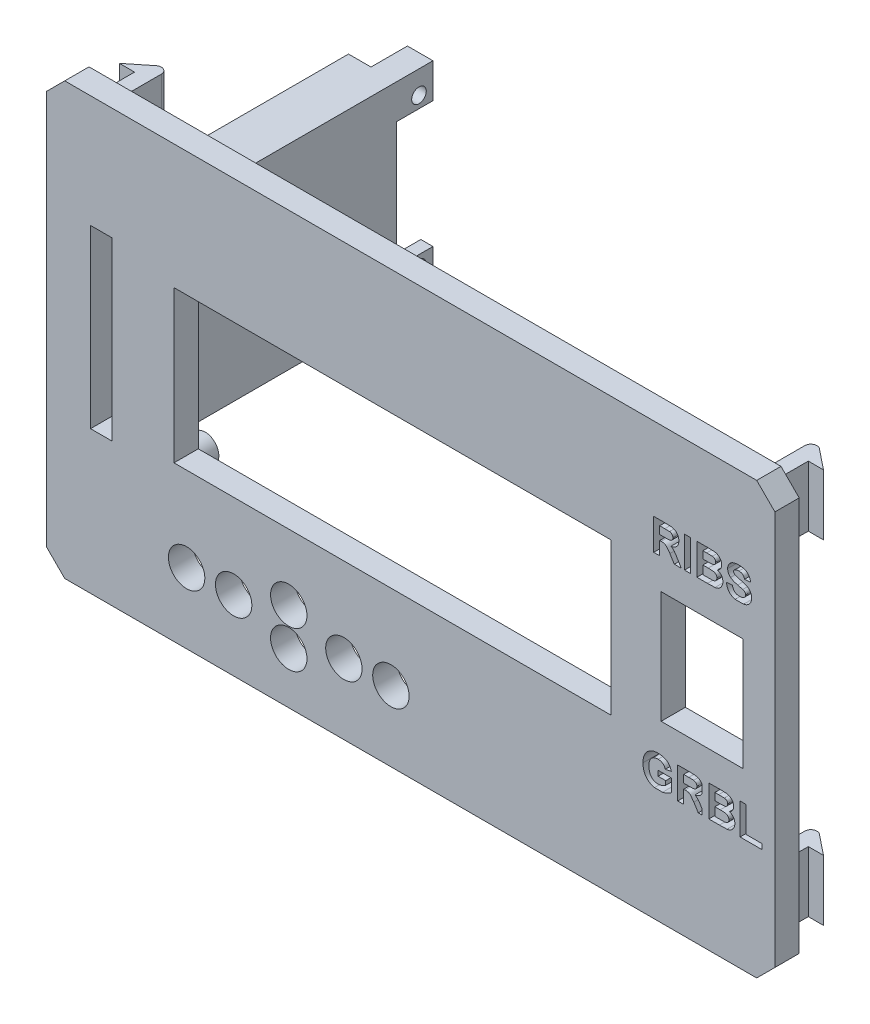
from build123d import *

# Parameters (mm, degrees)
SKETCH_1_W           = 120
SKETCH_1_H           = 60
EXTRUDE_1_DEPTH      = 4
SKETCH_2_W           = 72
SKETCH_2_H           = 25
CUT_EXTRUDE_1_DEPTH  = 68.201190466
SKETCH_3_W           = 6.75
SKETCH_3_H           = 18.5
CUT_EXTRUDE_2_DEPTH  = 68.201190466
SKETCH_4_W           = 1.75
SKETCH_4_H           = 29
CUT_EXTRUDE_3_DEPTH  = 68.201190466
SKETCH_5_W           = 120
SKETCH_5_H           = 4
EXTRUDE_2_DEPTH      = 5
SKETCH_6_W           = 120
SKETCH_6_H           = 4
EXTRUDE_3_DEPTH      = 10
SKETCH_7_R           = 2
CUT_EXTRUDE_4_DEPTH  = 73.221880341
SKETCH_8_R           = 2
CUT_EXTRUDE_5_DEPTH  = 73.221880341
SKETCH_10_R          = 2
CUT_EXTRUDE_6_DEPTH  = 73.221880341
SKETCH_11_R          = 2
CUT_EXTRUDE_8_DEPTH  = 10
SKETCH_12_R          = 3
CUT_EXTRUDE_9_DEPTH  = 10
SKETCH_13_R          = 2.25
EXTRUDE_4_DEPTH      = 3
SKETCH_14_W          = 68.3
SKETCH_14_H          = 3
CUT_EXTRUDE_10_DEPTH = 2
SKETCH_15_R          = 1.25
CUT_EXTRUDE_11_DEPTH = 6
EXTRUDE_5_DEPTH      = 40
EXTRUDE_6_DEPTH      = 6
CUT_EXTRUDE_12_DEPTH = 120.97740996
SKETCH_19_W          = 4
SKETCH_19_H          = 75
EXTRUDE_7_DEPTH      = 3
SKETCH_20_W          = 4
SKETCH_20_H          = 75
CUT_EXTRUDE_13_DEPTH = 3
SKETCH_21_W          = 0.987814879
SKETCH_21_H          = 5.13663737
CUT_EXTRUDE_15_DEPTH = 3
SKETCH_22_W          = 120
SKETCH_22_H          = 4
CUT_EXTRUDE_16_DEPTH = 2
SKETCH_23_W          = 120
SKETCH_23_H          = 4
CUT_EXTRUDE_17_DEPTH = 2
CHAMFER_1_SIZE       = 3
SKETCH_24_W          = 2.5
SKETCH_24_H          = 10
EXTRUDE_8_DEPTH      = 6
EXTRUDE_9_DEPTH      = 10
EXTRUDE_10_DEPTH     = 10
FILLET_1_R           = 1


with BuildPart() as part:
    # Эскиз1 → Бобышка-Вытянуть1 (new body)
    with BuildSketch(Plane.XY):
        Rectangle(SKETCH_1_W, SKETCH_1_H)
    extrude(amount=EXTRUDE_1_DEPTH)

    # Эскиз2 → Вырез-Вытянуть1 (cut, through all)
    with BuildSketch(Plane.XY.offset(4)):
        Rectangle(SKETCH_2_W, SKETCH_2_H)
    extrude(amount=-CUT_EXTRUDE_1_DEPTH, mode=Mode.SUBTRACT)

    # Эскиз3 → Вырез-Вытянуть2 (cut, through all)
    with BuildSketch(Plane.XY.offset(4)):
        with Locations((54.375, 0)):
            Rectangle(SKETCH_3_W, SKETCH_3_H)
        with Locations((47.625, 0)):
            Rectangle(SKETCH_3_W, SKETCH_3_H)
    extrude(amount=-CUT_EXTRUDE_2_DEPTH, mode=Mode.SUBTRACT)

    # Эскиз4 → Вырез-Вытянуть3 (cut, through all)
    with BuildSketch(Plane.XY.offset(4)):
        with Locations((-47.125, 0)):
            Rectangle(SKETCH_4_W, SKETCH_4_H)
        with Locations((-48.875, 0)):
            Rectangle(SKETCH_4_W, SKETCH_4_H)
    extrude(amount=-CUT_EXTRUDE_3_DEPTH, mode=Mode.SUBTRACT)

    # Эскиз5 → Бобышка-Вытянуть2 (add)
    with BuildSketch(Plane(origin=(0, 30, 0), x_dir=(1, 0, 0), z_dir=(0, 1, 0))):
        with Locations((0, -2)):
            Rectangle(SKETCH_5_W, SKETCH_5_H)
    extrude(amount=EXTRUDE_2_DEPTH)

    # Эскиз6 → Бобышка-Вытянуть3 (add)
    with BuildSketch(Plane.XZ.offset(30)):
        with Locations((0, 2)):
            Rectangle(SKETCH_6_W, SKETCH_6_H)
    extrude(amount=EXTRUDE_3_DEPTH)

    # Эскиз7 → Вырез-Вытянуть4 (cut, through all)
    with BuildSketch(Plane(origin=(0, 0, 0), x_dir=(-1, 0, 0), z_dir=(0, 0, -1))):
        with Locations((33.92, -26.42)):
            Circle(SKETCH_7_R)
    extrude(amount=-CUT_EXTRUDE_4_DEPTH, mode=Mode.SUBTRACT)

    # Эскиз8 → Вырез-Вытянуть5 (cut, through all)
    with BuildSketch(Plane(origin=(0, 0, 0), x_dir=(-1, 0, 0), z_dir=(0, 0, -1))):
        with Locations((26.173, -26.42)):
            Circle(SKETCH_8_R)
    extrude(amount=-CUT_EXTRUDE_5_DEPTH, mode=Mode.SUBTRACT)

    # Эскиз10 → Вырез-Вытянуть6 (cut, through all)
    with BuildSketch(Plane(origin=(0, 0, 0), x_dir=(-1, 0, 0), z_dir=(0, 0, -1))):
        with Locations((0.266, -26.42)):
            Circle(SKETCH_10_R)
        with Locations((8.013, -26.42)):
            Circle(SKETCH_10_R)
    extrude(amount=-CUT_EXTRUDE_6_DEPTH, mode=Mode.SUBTRACT)

    # Эскиз11 → Вырез-Вытянуть8 (cut)
    with BuildSketch(Plane(origin=(0, 0, 0), x_dir=(-1, 0, 0), z_dir=(0, 0, -1))):
        with Locations((17.093, -29.52)):
            Circle(SKETCH_11_R)
        with Locations((17.093, -23.35)):
            Circle(SKETCH_11_R)
    extrude(amount=-CUT_EXTRUDE_8_DEPTH, mode=Mode.SUBTRACT)

    # Эскиз12 → Вырез-Вытянуть9 (cut)
    with BuildSketch(Plane(origin=(0, 0, 0), x_dir=(-1, 0, 0), z_dir=(0, 0, -1))):
        with Locations((33.92, -26.42)):
            Circle(SKETCH_12_R)
        with Locations((26.173, -26.42)):
            Circle(SKETCH_12_R)
        with Locations((17.093, -29.52)):
            Circle(SKETCH_12_R)
        with Locations((17.093, -23.35)):
            Circle(SKETCH_12_R)
        with Locations((8.013, -26.42)):
            Circle(SKETCH_12_R)
        with Locations((0.266, -26.42)):
            Circle(SKETCH_12_R)
    extrude(amount=-CUT_EXTRUDE_9_DEPTH, mode=Mode.SUBTRACT)

    # Эскиз13 → Бобышка-Вытянуть4 (add)
    with BuildSketch(Plane(origin=(0, 0, 0), x_dir=(-1, 0, 0), z_dir=(0, 0, -1))):
        with Locations(Location((37.86, -14.789, 0), (0, 0, 180))):
            Circle(SKETCH_13_R)
        with Locations(Location((-37.64, -14.789, 0), (0, 0, 180))):
            Circle(SKETCH_13_R)
        with Locations(Location((-37.64, 16.711, 0), (0, 0, 180))):
            Circle(SKETCH_13_R)
        with Locations(Location((37.86, 16.711, 0), (0, 0, 180))):
            Circle(SKETCH_13_R)
    extrude(amount=EXTRUDE_4_DEPTH)

    # Эскиз14 → Вырез-Вытянуть10 (cut)
    with BuildSketch(Plane(origin=(0, 0, 0), x_dir=(-1, 0, 0), z_dir=(0, 0, -1))):
        with Locations((0.11, 17.461)):
            Rectangle(SKETCH_14_W, SKETCH_14_H)
    extrude(amount=-CUT_EXTRUDE_10_DEPTH, mode=Mode.SUBTRACT)

    # Эскиз15 → Вырез-Вытянуть11 (cut)
    with BuildSketch(Plane(origin=(0, 0, -3), x_dir=(-1, 0, 0), z_dir=(0, 0, -1))):
        with Locations((37.86, -14.789)):
            Circle(SKETCH_15_R)
        with Locations((37.86, 16.711)):
            Circle(SKETCH_15_R)
        with Locations((-37.64, 16.711)):
            Circle(SKETCH_15_R)
        with Locations((-37.64, -14.789)):
            Circle(SKETCH_15_R)
    extrude(amount=-CUT_EXTRUDE_11_DEPTH, mode=Mode.SUBTRACT)

    # Эскиз16 → Бобышка-Вытянуть5 (add)
    with BuildSketch(Plane(origin=(0, 0, 0), x_dir=(-1, 0, 0), z_dir=(0, 0, -1))):
        Polygon((51.25, -14.5), (51.25, 13.569290618), (51.25, 16.2), (43.337209662, 16.2), (43.337209662, -16), (51.25, -16), align=None)
        Polygon((49.75, 14.5), (49.75, -14.5), (46.25, -14.5), (45.337209662, -14.5), (45.337209662, 14.5), (45.337209662, 14.7), (49.75, 14.7), align=None, mode=Mode.SUBTRACT)
    extrude(amount=EXTRUDE_5_DEPTH)

    # Эскиз17 → Бобышка-Вытянуть6 (add)
    with BuildSketch(Plane(origin=(0, 0, -40), x_dir=(-1, 0, 0), z_dir=(0, 0, -1))):
        Polygon((43.337209662, 16.2), (43.337209662, 10.5), (45.337209662, 10.5), (45.337209662, 14.7), (47.543604831, 14.7), (47.543604831, 16.2), align=None)
        Polygon((47.543604831, -16), (47.543604831, -14.5), (45.337209662, -14.5), (45.337209662, -10.3), (43.337209662, -10.3), (43.337209662, -16), align=None)
    extrude(amount=EXTRUDE_6_DEPTH)

    # Эскиз18 → Вырез-Вытянуть12 (cut, through all)
    with BuildSketch(Plane(origin=(-43.337209662, 0, 0), x_dir=(0, 0, -1), z_dir=(1, 0, 0))):
        with BuildLine():
            ThreePointArc((43.7, -11.016), (42.5, -12.216), (43.7, -13.416))
            Line((43.7, -13.416), (43.7, -12.216))
            Line((43.7, -12.216), (43.7, -11.016))
        make_face()
        with BuildLine():
            Line((43.7, -12.216), (43.7, -13.416))
            ThreePointArc((43.7, -13.416), (44.548528137, -13.064528137), (44.9, -12.216))
            ThreePointArc((44.9, -12.216), (44.548528137, -11.367471863), (43.7, -11.016))
            Line((43.7, -11.016), (43.7, -12.216))
        make_face()
        with BuildLine():
            ThreePointArc((43.7, 13.616), (42.5, 12.416), (43.7, 11.216))
            Line((43.7, 11.216), (43.7, 13.616))
        make_face()
        with BuildLine():
            Line((43.7, 13.616), (43.7, 11.216))
            ThreePointArc((43.7, 11.216), (44.548528137, 11.567471863), (44.9, 12.416))
            ThreePointArc((44.9, 12.416), (44.548528137, 13.264528137), (43.7, 13.616))
        make_face()
    extrude(amount=-CUT_EXTRUDE_12_DEPTH, mode=Mode.SUBTRACT)

    # Эскиз19 → Бобышка-Вытянуть7 (add)
    with BuildSketch(Plane(origin=(60, 0, 0), x_dir=(0, 0, -1), z_dir=(1, 0, 0))):
        with Locations((-2, -2.5)):
            Rectangle(SKETCH_19_W, SKETCH_19_H)
    extrude(amount=EXTRUDE_7_DEPTH)

    # Эскиз20 → Вырез-Вытянуть13 (cut)
    with BuildSketch(Plane.ZY.offset(60)):
        with Locations((2, -2.5)):
            Rectangle(SKETCH_20_W, SKETCH_20_H)
    extrude(amount=-CUT_EXTRUDE_13_DEPTH, mode=Mode.SUBTRACT)

    # Эскиз21 → Вырез-Вытянуть15 (cut)
    # profile 1 of 8: a face of its own
    with BuildSketch(Plane.XY.offset(4)):
        Polygon((57.256160899, -14.11336263), (57.256160899, -19.25), (60.878148788, -19.25), (60.878148788, -18.393893772), (58.243975778, -18.393893772), (58.243975778, -14.11336263), align=None)
    # profile 2 of 8: a face of its own
    with BuildSketch(Plane.XY.offset(4)):
        with BuildLine():
            Line((52.119523529, -14.11336263), (52.119523529, -19.25))
            Line((52.119523529, -19.25), (53.858489306, -19.25))
            add(Edge.make_bspline(
                [(55.103547642, -19.21501489), (55.045322411, -19.220185633), (54.946583854, -19.227242946), (54.79966707, -19.232786931), (54.6556309, -19.238260275), (54.488578224, -19.24219051), (54.220351639, -19.246050896), (54.007705019, -19.249540881), (53.858489306, -19.25)],
                knots=[0, 0, 0, 0, 0.140766497, 0.238315848, 0.354022328, 0.487866729, 0.640687248, 1, 1, 1, 1], degree=3))
            add(Edge.make_bspline(
                [(56.400054671, -17.761074865), (56.399362919, -17.876865656), (56.380396983, -18.052332398), (56.310932338, -18.277819771), (56.240520589, -18.443526002), (56.152945886, -18.599776063), (56.050017915, -18.742433041), (55.929920019, -18.866552348), (55.796925805, -18.975942554), (55.647053468, -19.066415362), (55.418761428, -19.162111895), (55.232298125, -19.201586823), (55.103547642, -19.21501489)],
                knots=[0, 0, 0, 0, 0.162134877, 0.244884357, 0.329396712, 0.41363605, 0.495043982, 0.574816901, 0.654648996, 0.735397766, 0.818838922, 1, 1, 1, 1], degree=3))
            add(Edge.make_bspline(
                [(55.506905385, -16.520132423), (55.576021362, -16.542547797), (55.676779076, -16.580910554), (55.801475492, -16.648471023), (55.887560605, -16.703696898), (55.968032048, -16.764654285), (56.040546682, -16.833332617), (56.109263327, -16.905832782), (56.169591333, -16.98579186), (56.224197353, -17.069386096), (56.270549912, -17.15792382), (56.310686604, -17.249275267), (56.344256518, -17.344365892), (56.368175402, -17.443829938), (56.394083351, -17.582222318), (56.398595697, -17.689331837), (56.400054671, -17.761074865)],
                knots=[0, 0, 0, 0, 0.132556806, 0.195780264, 0.258216645, 0.318868125, 0.379477695, 0.440087264, 0.500738744, 0.56178533, 0.621918965, 0.682673484, 0.743575816, 0.805446126, 0.868974916, 1, 1, 1, 1], degree=3))
            add(Edge.make_bspline(
                [(56.202491695, -15.405753763), (56.203306389, -15.522404941), (56.180164906, -15.696918197), (56.10116081, -15.916458133), (56.018614829, -16.070147918), (55.917309299, -16.211070963), (55.757309728, -16.377195725), (55.611349452, -16.471818422), (55.506905385, -16.520132423)],
                knots=[0, 0, 0, 0, 0.252157198, 0.376787363, 0.502925804, 0.62834201, 0.751131965, 1, 1, 1, 1], degree=3))
            add(Edge.make_bspline(
                [(54.188789906, -14.11336263), (54.284815014, -14.114228536), (54.424146404, -14.114048036), (54.603133128, -14.12049562), (54.722617182, -14.124516318), (54.831904453, -14.133907019), (54.931853489, -14.141286067), (55.022149692, -14.151437301), (55.128520967, -14.167865126), (55.25221197, -14.193417415), (55.391917938, -14.240682253), (55.524345464, -14.299735041), (55.647504193, -14.374811626), (55.761802647, -14.462618409), (55.868117179, -14.562456009), (55.961535404, -14.678358751), (56.045682404, -14.804857703), (56.116612945, -14.942058752), (56.183035191, -15.141364576), (56.202633111, -15.299311994), (56.202491695, -15.405753763)],
                knots=[0, 0, 0, 0, 0.105884058, 0.15355278, 0.1974569, 0.237652956, 0.27445636, 0.307946195, 0.337787549, 0.393116516, 0.446925741, 0.500063811, 0.55265689, 0.60552249, 0.65874794, 0.713022825, 0.769236291, 0.82605694, 0.882736495, 1, 1, 1, 1], degree=3))
            Line((54.188789906, -14.11336263), (52.119523529, -14.11336263))
        make_face()
        with BuildLine():
            Line((53.107338408, -18.393893772), (53.107338408, -17.010952941))
            Line((53.107338408, -17.010952941), (53.987111035, -17.010952941))
            add(Edge.make_bspline(
                [(55.412239792, -17.71682899), (55.412678398, -17.64399113), (55.399462141, -17.536785496), (55.348043827, -17.40613013), (55.29596156, -17.320133933), (55.230813568, -17.242664915), (55.150298337, -17.17783511), (55.057336166, -17.123821489), (54.96871715, -17.088237986), (54.884683037, -17.06540903), (54.804532188, -17.05043281), (54.70793403, -17.038577901), (54.595356808, -17.028550411), (54.466344067, -17.020529538), (54.261952739, -17.011635623), (54.100289199, -17.011477849), (53.987111035, -17.010952941)],
                knots=[0, 0, 0, 0, 0.12069588, 0.176255416, 0.231266923, 0.286442241, 0.34292522, 0.401445762, 0.463857631, 0.500356262, 0.54545082, 0.598687676, 0.661395797, 0.732507568, 0.812630315, 1, 1, 1, 1], degree=3))
            add(Edge.make_bspline(
                [(54.863796739, -18.361995583), (54.940554815, -18.349669052), (55.0504176, -18.312910259), (55.179540892, -18.233131661), (55.261887168, -18.158116206), (55.329486824, -18.0681539), (55.397194747, -17.92325915), (55.41268467, -17.800139536), (55.412239792, -17.71682899)],
                knots=[0, 0, 0, 0, 0.250407824, 0.369282527, 0.487614715, 0.607842641, 0.730167532, 1, 1, 1, 1], degree=3))
            add(Edge.make_bspline(
                [(54.115732764, -18.393893772), (54.204936242, -18.39557902), (54.332152, -18.392105042), (54.492724192, -18.390614404), (54.593184713, -18.38575929), (54.67999412, -18.382059572), (54.769116923, -18.376517052), (54.828636783, -18.36785756), (54.863796739, -18.361995583)],
                knots=[0, 0, 0, 0, 0.356994199, 0.509418466, 0.642709622, 0.759541115, 0.857263317, 1, 1, 1, 1], degree=3))
            Line((54.115732764, -18.393893772), (53.107338408, -18.393893772))
        make_face(mode=Mode.SUBTRACT)
        with BuildLine():
            Line((53.107338408, -16.154846713), (53.107338408, -14.969468859))
            Line((53.107338408, -14.969468859), (53.733983472, -14.969468859))
            add(Edge.make_bspline(
                [(54.666233764, -14.986961414), (54.626565734, -14.982719003), (54.557554814, -14.98012167), (54.452905101, -14.976360256), (54.345897147, -14.973147296), (54.219665513, -14.971227799), (54.01352172, -14.970245088), (53.849575417, -14.968685169), (53.733983472, -14.969468859)],
                knots=[0, 0, 0, 0, 0.128239885, 0.22208111, 0.336874893, 0.472602106, 0.628175186, 1, 1, 1, 1], degree=3))
            add(Edge.make_bspline(
                [(55.214676816, -15.553925995), (55.21649753, -15.480473167), (55.199081409, -15.373053293), (55.140010966, -15.244699981), (55.077643875, -15.164159032), (54.999276742, -15.096171173), (54.865248754, -15.021793433), (54.747245956, -14.998159305), (54.666233764, -14.986961414)],
                knots=[0, 0, 0, 0, 0.250585524, 0.366013953, 0.47979182, 0.596199355, 0.718553119, 1, 1, 1, 1], degree=3))
            add(Edge.make_bspline(
                [(54.613756098, -16.137354158), (54.698968319, -16.126437924), (54.823393391, -16.101246625), (54.967147883, -16.025547691), (55.056214644, -15.957709177), (55.126847471, -15.87444575), (55.198012887, -15.743547156), (55.214140273, -15.62974856), (55.214676816, -15.553925995)],
                knots=[0, 0, 0, 0, 0.279180569, 0.403146506, 0.522444612, 0.638838486, 0.753412678, 1, 1, 1, 1], degree=3))
            add(Edge.make_bspline(
                [(53.822475221, -16.154846713), (53.918517321, -16.155617321), (54.055023811, -16.154069718), (54.227212386, -16.153080834), (54.333895429, -16.151156105), (54.425465788, -16.147917556), (54.517086753, -16.144170595), (54.57820681, -16.141458558), (54.613756098, -16.137354158)],
                knots=[0, 0, 0, 0, 0.363928509, 0.517301829, 0.652498452, 0.768239873, 0.864498693, 1, 1, 1, 1], degree=3))
            Line((53.822475221, -16.154846713), (53.107338408, -16.154846713))
        make_face(mode=Mode.SUBTRACT)
    # profile 3 of 8: a face of its own
    with BuildSketch(Plane.XY.offset(4)):
        with BuildLine():
            Line((51, -16.183461309), (51, -14.902241447))
            add(Edge.make_bspline(
                [(49.138586338, -14.11336263), (49.26479759, -14.114004843), (49.447587509, -14.115593882), (49.68134182, -14.132108232), (49.836278165, -14.145569139), (49.977016975, -14.165157474), (50.104113613, -14.188623395), (50.217354358, -14.215817322), (50.3183914, -14.248386421), (50.41051666, -14.285662896), (50.496335859, -14.330032386), (50.576792605, -14.382016698), (50.653122635, -14.439824073), (50.725649175, -14.503543337), (50.792383936, -14.574860815), (50.8544896, -14.652714568), (50.911916114, -14.736456847), (50.959652312, -14.820684308), (50.988072752, -14.8766094), (51, -14.902241447)],
                knots=[0, 0, 0, 0, 0.134567806, 0.194654679, 0.249727294, 0.300288627, 0.346032105, 0.387437549, 0.424315851, 0.459073089, 0.493244826, 0.5271141, 0.561038568, 0.595222036, 0.629875307, 0.66498639, 0.701285794, 0.737967896, 0.768099566, 0.768099566, 0.768099566, 0.768099566], degree=3))
            Line((49.138586338, -14.11336263), (46.98288616, -14.11336263))
            Line((46.98288616, -14.11336263), (46.98288616, -19.25))
            Line((46.98288616, -19.25), (47.970701038, -19.25))
            Line((47.970701038, -19.25), (47.970701038, -17.076807267))
            Line((47.970701038, -17.076807267), (48.191930412, -17.076807267))
            add(Edge.make_bspline(
                [(49.641754542, -18.084172648), (49.577696091, -17.995038042), (49.48617796, -17.867657262), (49.367069146, -17.708904586), (49.292585593, -17.608420592), (49.224453096, -17.52306347), (49.164740418, -17.45134589), (49.114663833, -17.391728871), (49.058002053, -17.332616007), (48.992082087, -17.271864551), (48.910478432, -17.212962131), (48.826679059, -17.166007188), (48.736894692, -17.130174235), (48.633061923, -17.105211319), (48.450338886, -17.081771215), (48.300151361, -17.075476493), (48.191930412, -17.076807267)],
                knots=[0, 0, 0, 0, 0.174865068, 0.249829139, 0.316160129, 0.374099921, 0.423769715, 0.464839405, 0.498074588, 0.554160746, 0.60738754, 0.658015759, 0.7068185, 0.760885579, 0.827647236, 1, 1, 1, 1], degree=3))
            Line((49.641754542, -18.084172648), (50.372325962, -19.25))
            Line((50.372325962, -19.25), (51, -19.25))
            Line((51, -19.25), (51, -18.389648617))
            Line((51, -18.389648617), (50.904305434, -18.233373854))
            add(Edge.make_bspline(
                [(49.843433413, -16.949214511), (49.942625885, -17.012742493), (50.083700181, -17.113817956), (50.250023252, -17.267359138), (50.342479793, -17.367407932), (50.413509594, -17.455416598), (50.470702966, -17.532385744), (50.532394116, -17.620967573), (50.597980791, -17.721207446), (50.669393219, -17.832223733), (50.77301534, -18.003688521), (50.851324961, -18.139038574), (50.904305434, -18.233373854)],
                knots=[0, 0, 0, 0, 0.209649261, 0.307658185, 0.402218569, 0.451671994, 0.50877915, 0.572757208, 0.643659616, 0.721852347, 0.807549467, 1, 1, 1, 1], degree=3))
            add(Edge.make_bspline(
                [(51, -16.183461309), (50.984446716, -16.21674858), (50.949423575, -16.285364745), (50.885971982, -16.385110101), (50.810167515, -16.481301292), (50.724271936, -16.570572534), (50.627909223, -16.651087386), (50.521767001, -16.723157858), (50.405204311, -16.786378672), (50.279028394, -16.840394003), (50.092699517, -16.90268437), (49.945058979, -16.933275753), (49.843433413, -16.949214511)],
                knots=[0.314571643, 0.314571643, 0.314571643, 0.314571643, 0.366645189, 0.42372163, 0.481910522, 0.5400445, 0.599083027, 0.659656408, 0.721688575, 0.786832952, 0.854048925, 1, 1, 1, 1], degree=3))
        make_face()
        with BuildLine():
            Line((48.766097811, -16.220701038), (47.970701038, -16.220701038))
            Line((47.970701038, -16.220701038), (47.970701038, -14.969468859))
            Line((47.970701038, -14.969468859), (48.810343685, -14.969468859))
            add(Edge.make_bspline(
                [(49.595450719, -14.98593244), (49.56301346, -14.981653473), (49.50564711, -14.97912727), (49.41849861, -14.975066358), (49.32825857, -14.973586248), (49.221944967, -14.971082542), (49.047347545, -14.970363669), (48.908445875, -14.96861397), (48.810343685, -14.969468859)],
                knots=[0, 0, 0, 0, 0.124812716, 0.219210218, 0.333205091, 0.469464021, 0.625352362, 1, 1, 1, 1], degree=3))
            add(Edge.make_bspline(
                [(50.143893772, -15.581708289), (50.1429498, -15.505863776), (50.129693237, -15.392937783), (50.065641527, -15.261016964), (50.001865472, -15.177518496), (49.921736843, -15.107050399), (49.789742491, -15.029409497), (49.674855427, -14.99890848), (49.595450719, -14.98593244)],
                knots=[0, 0, 0, 0, 0.256355572, 0.372787533, 0.488671199, 0.607002185, 0.728890297, 1, 1, 1, 1], degree=3))
            add(Edge.make_bspline(
                [(48.766097811, -16.220701038), (48.883088411, -16.221345285), (49.04942034, -16.218028197), (49.259407671, -16.213595902), (49.389373772, -16.205864631), (49.50128949, -16.198187678), (49.594706198, -16.188214289), (49.670410882, -16.176425339), (49.746027157, -16.158096787), (49.823483825, -16.126162924), (49.906038354, -16.080679438), (49.976594362, -16.021676013), (50.037716991, -15.95345853), (50.08432699, -15.873276272), (50.134481067, -15.751735768), (50.141758594, -15.649721469), (50.143893772, -15.581708289)],
                knots=[0, 0, 0, 0, 0.202180464, 0.287584002, 0.362990417, 0.427193792, 0.481468039, 0.525327026, 0.559548474, 0.615694354, 0.669594952, 0.721819746, 0.773909767, 0.827084939, 0.881359186, 1, 1, 1, 1], degree=3))
        make_face(mode=Mode.SUBTRACT)
    # profile 4 of 8: a face of its own
    with BuildSketch(Plane.XY.offset(4)):
        with BuildLine():
            Line((43.164862321, -19.25), (44.490680441, -19.25))
            add(Edge.make_bspline(
                [(45.995071281, -18.547210873), (45.938246481, -18.599881893), (45.846790476, -18.676425762), (45.711844007, -18.767495093), (45.599216565, -18.835225548), (45.478343126, -18.902046529), (45.348277252, -18.966087423), (45.208677888, -19.026154712), (45.013249015, -19.105923852), (44.773485426, -19.184467233), (44.580312221, -19.231889303), (44.490680441, -19.25)],
                knots=[0, 0, 0, 0, 0.099090268, 0.152122531, 0.208002989, 0.267082027, 0.328664982, 0.393274569, 0.461353948, 0.598506962, 0.715400037, 0.715400037, 0.715400037, 0.715400037], degree=3))
            Line((45.995071281, -18.547210873), (45.995071281, -16.484118339))
            Line((45.995071281, -16.484118339), (43.756024222, -16.484118339))
            Line((43.756024222, -16.484118339), (43.756024222, -17.340224568))
            Line((43.756024222, -17.340224568), (45.007256402, -17.340224568))
            Line((45.007256402, -17.340224568), (45.007256402, -18.010086532))
            add(Edge.make_bspline(
                [(43.756024222, -18.459748097), (43.868725744, -18.460397363), (44.038557966, -18.441487355), (44.262392276, -18.389468169), (44.428335639, -18.330723215), (44.589425344, -18.263126328), (44.786204559, -18.161840793), (44.924506808, -18.076249021), (45.007256402, -18.010086532)],
                knots=[0, 0, 0, 0, 0.249643785, 0.377964706, 0.509161474, 0.639800558, 0.765422087, 1, 1, 1, 1], degree=3))
            add(Edge.make_bspline(
                [(42.241374741, -16.622000833), (42.241197873, -16.765996594), (42.251766942, -16.975784939), (42.29654629, -17.243469393), (42.342963503, -17.423458413), (42.401426124, -17.58958021), (42.471687624, -17.742363333), (42.558402164, -17.878973217), (42.656077895, -18.002148157), (42.765249751, -18.109777332), (42.882856146, -18.203612538), (43.008242242, -18.283130245), (43.142564768, -18.347095845), (43.284127744, -18.397955039), (43.488105349, -18.446709834), (43.64779978, -18.4597945), (43.756024222, -18.459748097)],
                knots=[0, 0, 0, 0, 0.160105823, 0.2328081, 0.301324776, 0.366436098, 0.428343612, 0.48778755, 0.545837416, 0.602717553, 0.657790602, 0.712789709, 0.76735372, 0.822822515, 0.879688597, 1, 1, 1, 1], degree=3))
            add(Edge.make_bspline(
                [(43.75808217, -14.903614533), (43.647711335, -14.905029838), (43.484882433, -14.914745081), (43.277263237, -14.961581698), (43.133753383, -15.008780099), (42.998711135, -15.069405558), (42.873966328, -15.145674809), (42.7564116, -15.233086278), (42.649392416, -15.335676897), (42.552338385, -15.450710486), (42.468319895, -15.579558933), (42.398378239, -15.721805777), (42.341078629, -15.876736856), (42.295509503, -16.04435816), (42.25267474, -16.293319234), (42.240651685, -16.488189978), (42.241374741, -16.622000833)],
                knots=[0, 0, 0, 0, 0.127317881, 0.186832172, 0.244669667, 0.301064616, 0.356888044, 0.412745006, 0.469465526, 0.527226076, 0.585734188, 0.646152756, 0.709401601, 0.775714492, 0.845920581, 1, 1, 1, 1], degree=3))
            add(Edge.make_bspline(
                [(44.941402077, -15.759720762), (44.923392586, -15.695433131), (44.890152911, -15.601827459), (44.831803149, -15.485256836), (44.782957256, -15.403828493), (44.727806071, -15.327786912), (44.66505702, -15.257942076), (44.598646924, -15.191110864), (44.524241447, -15.131944228), (44.444930973, -15.078606051), (44.361609413, -15.030507912), (44.272393836, -14.991504975), (44.178534548, -14.960110179), (44.080487936, -14.933497242), (43.940009158, -14.911033478), (43.831822135, -14.902145059), (43.75808217, -14.903614533)],
                knots=[0, 0, 0, 0, 0.126731531, 0.187868754, 0.247151356, 0.306786759, 0.365822221, 0.425204818, 0.485391954, 0.545877595, 0.60651718, 0.667723681, 0.730306396, 0.794255591, 0.860288131, 1, 1, 1, 1], degree=3))
            Line((44.941402077, -15.759720762), (45.929216955, -15.562157786))
            add(Edge.make_bspline(
                [(43.77145883, -14.047508305), (43.92017783, -14.047941872), (44.138111108, -14.05739536), (44.417979614, -14.101195092), (44.609689129, -14.145008732), (44.788499198, -14.201388898), (44.954099194, -14.270690122), (45.107506206, -14.351529732), (45.246498241, -14.44714449), (45.373899824, -14.552571167), (45.489379751, -14.66793759), (45.592979865, -14.793415476), (45.684786068, -14.928370507), (45.764010196, -15.073371632), (45.856511239, -15.281475364), (45.904253509, -15.448183345), (45.929216955, -15.562157786)],
                knots=[0, 0, 0, 0, 0.154507723, 0.225880691, 0.293868156, 0.358517473, 0.420292614, 0.480038843, 0.538219152, 0.59512551, 0.651533794, 0.707437299, 0.763838838, 0.820740738, 0.878776993, 1, 1, 1, 1], degree=3))
            add(Edge.make_bspline(
                [(42.557269708, -14.301664841), (42.640434212, -14.257264654), (42.773117916, -14.203229795), (42.957693125, -14.143716716), (43.10628222, -14.109708337), (43.262169151, -14.081848596), (43.484160561, -14.053444935), (43.655467379, -14.048545964), (43.77145883, -14.047508305)],
                knots=[0, 0, 0, 0, 0.225442453, 0.342642947, 0.464217678, 0.590258596, 0.721934577, 1, 1, 1, 1], degree=3))
            add(Edge.make_bspline(
                [(41.253559862, -16.66418876), (41.25336792, -16.534963512), (41.263512905, -16.343434693), (41.297410292, -16.0930612), (41.335198868, -15.913609302), (41.381231189, -15.739255286), (41.437395617, -15.570113709), (41.506213521, -15.407437846), (41.58276613, -15.249836313), (41.669911512, -15.099489059), (41.768380066, -14.958322778), (41.87526135, -14.824920152), (41.992654574, -14.701376155), (42.120193976, -14.587840741), (42.303354491, -14.446484799), (42.452144598, -14.354151202), (42.557269708, -14.301664841)],
                knots=[0, 0, 0, 0, 0.136153305, 0.201841243, 0.266067893, 0.329283682, 0.391808476, 0.453702141, 0.515293198, 0.576359105, 0.636620579, 0.696515605, 0.756344062, 0.815989889, 0.876288209, 1, 1, 1, 1], degree=3))
            add(Edge.make_bspline(
                [(43.164862321, -19.25), (43.137524766, -19.244173581), (43.052718847, -19.224924163), (42.912720464, -19.187732195), (42.748314025, -19.129816035), (42.591019919, -19.060289269), (42.439413162, -18.982816801), (42.296320044, -18.893833161), (42.161602338, -18.796493051), (42.036235107, -18.689949733), (41.92066779, -18.573988461), (41.813352767, -18.44940788), (41.715542161, -18.315613913), (41.627827479, -18.172452099), (41.549125964, -18.021718244), (41.479109966, -17.864738023), (41.420028319, -17.7027469), (41.368232889, -17.538096996), (41.325656972, -17.370209558), (41.294408235, -17.198541409), (41.261636713, -16.963694686), (41.254979898, -16.784332896), (41.253559862, -16.66418876)],
                knots=[0.15975953, 0.15975953, 0.15975953, 0.15975953, 0.179853926, 0.22226821, 0.263839627, 0.30502967, 0.345839247, 0.386148018, 0.426054211, 0.465240705, 0.504301289, 0.543648081, 0.5833549, 0.623324286, 0.664247706, 0.705537289, 0.746812141, 0.788151037, 0.829600122, 0.87124462, 0.913549792, 1, 1, 1, 1], degree=3))
        make_face()
    # profile 5 of 8: a face of its own
    with BuildSketch(Plane.XY.offset(4)):
        with BuildLine():
            add(Edge.make_bspline(
                [(56.450082822, 14.25), (56.388548814, 14.26325425), (56.266109176, 14.294811137), (56.089503925, 14.357225795), (55.923716202, 14.435440898), (55.772653275, 14.528845128), (55.634444114, 14.635168511), (55.510930374, 14.756349768), (55.39986587, 14.88987772), (55.302752325, 15.036954953), (55.219640305, 15.197350996), (55.148480697, 15.37020032), (55.068091156, 15.623449813), (55.034045904, 15.82479625), (55.01711384, 15.962212457)],
                knots=[0.219440513, 0.219440513, 0.219440513, 0.219440513, 0.280667633, 0.342309533, 0.401420803, 0.458656018, 0.514793041, 0.570722374, 0.626652703, 0.683481768, 0.741844128, 0.802143543, 0.865151469, 1, 1, 1, 1], degree=3))
            Line((56.450082822, 14.25), (57.83498223, 14.25))
            add(Edge.make_bspline(
                [(59.165936331, 15.759504612), (59.165682505, 15.687232716), (59.157960948, 15.57947637), (59.133425136, 15.438249577), (59.106522729, 15.33467147), (59.070787031, 15.233069964), (59.030562624, 15.131978339), (58.980260964, 15.03360128), (58.923011649, 14.937857283), (58.859862829, 14.844818203), (58.788303549, 14.758991771), (58.71253685, 14.67751461), (58.627721462, 14.604948987), (58.53909492, 14.535419222), (58.44260354, 14.473842494), (58.340507972, 14.41812101), (58.232162684, 14.368670769), (58.117183536, 14.32557941), (57.995719848, 14.287224884), (57.900462595, 14.264053715), (57.846134469, 14.252338885), (57.83498223, 14.25)],
                knots=[0, 0, 0, 0, 0.074518536, 0.11115814, 0.147708838, 0.184737432, 0.222181062, 0.259832986, 0.29853867, 0.337199066, 0.375653374, 0.413687226, 0.451790108, 0.490634563, 0.529785459, 0.569677268, 0.610517686, 0.652500333, 0.696246271, 0.741804016, 0.753554431, 0.753554431, 0.753554431, 0.753554431], degree=3))
            add(Edge.make_bspline(
                [(56.354779822, 17.796872799), (56.39489046, 17.763886852), (56.469660928, 17.722231454), (56.582528776, 17.670175158), (56.691994388, 17.628437), (56.818622972, 17.58688346), (56.962326965, 17.543460824), (57.123225491, 17.499466375), (57.297207629, 17.456856527), (57.4738492, 17.41497451), (57.642413204, 17.369185345), (57.799153532, 17.324544519), (57.943343364, 17.277753671), (58.075725988, 17.23220293), (58.195658331, 17.185419037), (58.303963898, 17.13985676), (58.430260195, 17.077205402), (58.573404344, 16.992341606), (58.723435564, 16.868977925), (58.856119022, 16.730309092), (58.948569362, 16.599553942), (59.012077834, 16.487101048), (59.052970799, 16.397462958), (59.088345599, 16.303007165), (59.117143765, 16.203628557), (59.138003408, 16.099190135), (59.161523294, 15.951487027), (59.165278497, 15.837059021), (59.165936331, 15.759504612)],
                knots=[0, 0, 0, 0, 0.040851055, 0.067419906, 0.098235656, 0.133389739, 0.172760946, 0.216897504, 0.265231778, 0.314355842, 0.360395205, 0.403300321, 0.4431725, 0.480216473, 0.513952305, 0.544926296, 0.573058188, 0.625371145, 0.676059628, 0.726117637, 0.776674693, 0.802167523, 0.828130405, 0.854469988, 0.881844283, 0.909814996, 0.938613221, 1, 1, 1, 1], degree=3))
            add(Edge.make_bspline(
                [(56.202491695, 18.102478027), (56.201180291, 18.045137717), (56.229673461, 17.927309174), (56.307981067, 17.835090895), (56.354779822, 17.796872799)],
                knots=[0, 0, 0, 0, 0.485260731, 1, 1, 1, 1], degree=3))
            add(Edge.make_bspline(
                [(56.364040587, 18.414257098), (56.31406518, 18.379459074), (56.227421457, 18.286868828), (56.202691609, 18.162703423), (56.202491695, 18.102478027)],
                knots=[0, 0, 0, 0, 0.502501839, 1, 1, 1, 1], degree=3))
            add(Edge.make_bspline(
                [(57.05756895, 18.596385467), (56.987549985, 18.595585084), (56.884952577, 18.59198342), (56.753493912, 18.571844712), (56.66352808, 18.552799208), (56.579559132, 18.526840108), (56.477460181, 18.485516885), (56.407215079, 18.444583994), (56.364040587, 18.414257098)],
                knots=[0, 0, 0, 0, 0.288592084, 0.421400511, 0.54715205, 0.666859264, 0.78276635, 1, 1, 1, 1], degree=3))
            add(Edge.make_bspline(
                [(57.980558477, 17.871987889), (57.970797476, 17.932589163), (57.949871537, 18.019996679), (57.912352932, 18.129750234), (57.880496741, 18.203223674), (57.841985271, 18.268881518), (57.800081332, 18.328795587), (57.753620046, 18.382166015), (57.70106532, 18.42753174), (57.644222597, 18.468812668), (57.579441935, 18.501900306), (57.509437803, 18.532598288), (57.43154645, 18.555675888), (57.347265821, 18.573980853), (57.222224152, 18.592688934), (57.124458793, 18.594981926), (57.05756895, 18.596385467)],
                knots=[0, 0, 0, 0, 0.140206794, 0.204904728, 0.264912442, 0.322857486, 0.378531407, 0.431843291, 0.484048878, 0.536897776, 0.591950242, 0.649895286, 0.711384645, 0.777188929, 0.846914455, 1, 1, 1, 1], degree=3))
            Line((57.980558477, 17.871987889), (58.968373356, 17.937842214))
            add(Edge.make_bspline(
                [(57.045221264, 19.452491695), (57.193372361, 19.453047761), (57.409096849, 19.441364058), (57.685072062, 19.398229929), (57.870852698, 19.353501807), (58.041850248, 19.294337736), (58.198726557, 19.223877152), (58.341348536, 19.140219027), (58.467979941, 19.042887341), (58.580796115, 18.935585176), (58.679211173, 18.81838012), (58.763596611, 18.692752371), (58.834514717, 18.558793606), (58.890156023, 18.415815642), (58.945885016, 18.209755225), (58.963830859, 18.047664834), (58.968373356, 17.937842214)],
                knots=[0, 0, 0, 0, 0.161083624, 0.234349509, 0.303452983, 0.368554297, 0.430806475, 0.490159468, 0.547891088, 0.604074648, 0.659129233, 0.713948385, 0.768330704, 0.823594561, 0.880408283, 1, 1, 1, 1], degree=3))
            add(Edge.make_bspline(
                [(55.214676816, 18.033536781), (55.213534914, 18.160620022), (55.242347535, 18.35134597), (55.333659054, 18.591467091), (55.41244898, 18.73452272), (55.488277691, 18.84274382), (55.551231493, 18.920402436), (55.620396707, 18.993083391), (55.696715581, 19.059013848), (55.77735558, 19.122055595), (55.865440663, 19.178037787), (55.958473319, 19.230768479), (56.093102729, 19.293285658), (56.275888273, 19.358378799), (56.604533396, 19.434564616), (56.865942084, 19.451739396), (57.045221264, 19.452491695)],
                knots=[0, 0, 0, 0, 0.146314323, 0.219931336, 0.295355331, 0.333985137, 0.372228167, 0.410559072, 0.449521648, 0.488450069, 0.52849996, 0.569766092, 0.611707391, 0.699546777, 0.793005267, 1, 1, 1, 1], degree=3))
            add(Edge.make_bspline(
                [(55.689033753, 17.009707818), (55.613861486, 17.077389671), (55.508951849, 17.185206966), (55.398126314, 17.348384308), (55.330731644, 17.474112805), (55.278939804, 17.606128579), (55.22905261, 17.791335638), (55.213887219, 17.936084411), (55.214676816, 18.033536781)],
                knots=[0, 0, 0, 0, 0.260864037, 0.384834792, 0.506941124, 0.627504104, 0.749213612, 1, 1, 1, 1], degree=3))
            add(Edge.make_bspline(
                [(56.863092895, 16.50551064), (56.732459038, 16.535821314), (56.545952417, 16.590276295), (56.309300348, 16.670005886), (56.15473049, 16.732229349), (56.014823684, 16.795232525), (55.85708649, 16.882027077), (55.750852547, 16.955723424), (55.689033753, 17.009707818)],
                knots=[0, 0, 0, 0, 0.312041473, 0.452204351, 0.581220078, 0.699855321, 0.809223885, 1, 1, 1, 1], degree=3))
            add(Edge.make_bspline(
                [(57.696561699, 16.282223318), (57.656952085, 16.296248476), (57.589055266, 16.315448294), (57.489183552, 16.344417572), (57.392291106, 16.371527078), (57.28034768, 16.399231677), (57.103041317, 16.447252314), (56.961503636, 16.479356727), (56.863092895, 16.50551064)],
                knots=[0, 0, 0, 0, 0.14596901, 0.24521524, 0.36149782, 0.495675826, 0.646054597, 1, 1, 1, 1], degree=3))
            add(Edge.make_bspline(
                [(58.178121453, 15.749214873), (58.179538579, 15.806586562), (58.165460218, 15.890822605), (58.120821109, 15.993704238), (58.071641764, 16.062482263), (58.005429924, 16.125323167), (57.884482628, 16.209597958), (57.774354487, 16.253433914), (57.696561699, 16.282223318)],
                knots=[0, 0, 0, 0, 0.221300038, 0.325895239, 0.431604924, 0.546140152, 0.677623396, 1, 1, 1, 1], degree=3))
            add(Edge.make_bspline(
                [(57.149147621, 15.040251903), (57.229289993, 15.039485333), (57.345735566, 15.046446932), (57.495084175, 15.06797349), (57.595134769, 15.092535351), (57.688553963, 15.120041149), (57.773022432, 15.157661168), (57.849906842, 15.201052752), (57.919009289, 15.25029038), (57.979314741, 15.304898597), (58.032074058, 15.361907728), (58.078020118, 15.420086341), (58.114196091, 15.482015478), (58.143425079, 15.545192804), (58.169517424, 15.633973226), (58.178477306, 15.70273089), (58.178121453, 15.749214873)],
                knots=[0, 0, 0, 0, 0.172353431, 0.250758782, 0.324349222, 0.393927901, 0.460036673, 0.522848465, 0.583690358, 0.642236357, 0.697606006, 0.750761271, 0.801401757, 0.851620817, 0.900196157, 1, 1, 1, 1], degree=3))
            add(Edge.make_bspline(
                [(56.004928719, 16.028066782), (56.018022305, 15.947341291), (56.047951699, 15.831734378), (56.099462226, 15.685414538), (56.144100561, 15.587642174), (56.193018891, 15.496962985), (56.250176094, 15.415948119), (56.311599403, 15.342014055), (56.380325589, 15.277815374), (56.455202087, 15.221589448), (56.536602282, 15.173637605), (56.623644164, 15.132136306), (56.716540681, 15.097954046), (56.816248728, 15.072464965), (56.960489917, 15.04755543), (57.072797375, 15.040520574), (57.149147621, 15.040251903)],
                knots=[0, 0, 0, 0, 0.146236365, 0.213455589, 0.277502177, 0.338529723, 0.397651501, 0.454744563, 0.510361653, 0.565638574, 0.622097121, 0.679239716, 0.738115332, 0.799043897, 0.863264002, 1, 1, 1, 1], degree=3))
            Line((56.004928719, 16.028066782), (55.01711384, 15.962212457))
        make_face()
    # profile 6 of 8: a face of its own
    with BuildSketch(Plane.XY.offset(4)):
        with BuildLine():
            Line((50.143893772, 19.38663737), (50.143893772, 14.25))
            Line((50.143893772, 14.25), (51, 14.25))
            Line((51, 14.25), (51.882859548, 14.25))
            add(Edge.make_bspline(
                [(53.127917885, 14.28498511), (53.069692653, 14.279814367), (52.970954096, 14.272757054), (52.824037313, 14.267213069), (52.680001143, 14.261739725), (52.512948466, 14.25780949), (52.244721881, 14.253949104), (52.032075262, 14.250459119), (51.882859548, 14.25)],
                knots=[0, 0, 0, 0, 0.140766497, 0.238315848, 0.354022328, 0.487866729, 0.640687248, 1, 1, 1, 1], degree=3))
            add(Edge.make_bspline(
                [(54.424424913, 15.738925135), (54.423733161, 15.623134344), (54.404767226, 15.447667602), (54.335302581, 15.222180229), (54.264890832, 15.056473998), (54.177316128, 14.900223937), (54.074388158, 14.757566959), (53.954290261, 14.633447652), (53.821296048, 14.524057446), (53.671423711, 14.433584638), (53.443131671, 14.337888105), (53.256668367, 14.298413177), (53.127917885, 14.28498511)],
                knots=[0, 0, 0, 0, 0.162134877, 0.244884357, 0.329396712, 0.41363605, 0.495043982, 0.574816901, 0.654648996, 0.735397766, 0.818838922, 1, 1, 1, 1], degree=3))
            add(Edge.make_bspline(
                [(53.531275627, 16.979867577), (53.600391605, 16.957452203), (53.701149318, 16.919089446), (53.825845734, 16.851528977), (53.911930847, 16.796303102), (53.992402291, 16.735345715), (54.064916924, 16.666667383), (54.13363357, 16.594167218), (54.193961576, 16.51420814), (54.248567595, 16.430613904), (54.294920154, 16.34207618), (54.335056846, 16.250724733), (54.368626761, 16.155634108), (54.392545645, 16.056170062), (54.418453594, 15.917777682), (54.422965939, 15.810668163), (54.424424913, 15.738925135)],
                knots=[0, 0, 0, 0, 0.132556806, 0.195780264, 0.258216645, 0.318868125, 0.379477695, 0.440087264, 0.500738744, 0.56178533, 0.621918965, 0.682673484, 0.743575816, 0.805446126, 0.868974916, 1, 1, 1, 1], degree=3))
            add(Edge.make_bspline(
                [(54.226861937, 18.094246237), (54.227676631, 17.977595059), (54.204535149, 17.803081803), (54.125531053, 17.583541867), (54.042985071, 17.429852082), (53.941679541, 17.288929037), (53.78167997, 17.122804275), (53.635719694, 17.028181578), (53.531275627, 16.979867577)],
                knots=[0, 0, 0, 0, 0.252157198, 0.376787363, 0.502925804, 0.62834201, 0.751131965, 1, 1, 1, 1], degree=3))
            add(Edge.make_bspline(
                [(52.213160148, 19.38663737), (52.309185257, 19.385771464), (52.448516646, 19.385951964), (52.62750337, 19.37950438), (52.746987425, 19.375483682), (52.856274696, 19.366092981), (52.956223732, 19.358713933), (53.046519935, 19.348562699), (53.152891209, 19.332134874), (53.276582212, 19.306582585), (53.416288181, 19.259317747), (53.548715707, 19.200264959), (53.671874435, 19.125188374), (53.786172889, 19.037381591), (53.892487422, 18.937543991), (53.985905646, 18.821641249), (54.070052646, 18.695142297), (54.140983188, 18.557941248), (54.207405433, 18.358635424), (54.227003353, 18.200688006), (54.226861937, 18.094246237)],
                knots=[0, 0, 0, 0, 0.105884058, 0.15355278, 0.1974569, 0.237652956, 0.27445636, 0.307946195, 0.337787549, 0.393116516, 0.446925741, 0.500063811, 0.55265689, 0.60552249, 0.65874794, 0.713022825, 0.769236291, 0.82605694, 0.882736495, 1, 1, 1, 1], degree=3))
            Line((52.213160148, 19.38663737), (50.143893772, 19.38663737))
        make_face()
        with BuildLine():
            Line((51.131708651, 15.106106228), (51.131708651, 16.489047059))
            Line((51.131708651, 16.489047059), (52.011481277, 16.489047059))
            add(Edge.make_bspline(
                [(53.436610034, 15.78317101), (53.43704864, 15.85600887), (53.423832383, 15.963214504), (53.37241407, 16.09386987), (53.320331802, 16.179866067), (53.255183811, 16.257335085), (53.174668579, 16.32216489), (53.081706408, 16.376178511), (52.993087392, 16.411762014), (52.909053279, 16.43459097), (52.828902431, 16.44956719), (52.732304273, 16.461422099), (52.61972705, 16.471449589), (52.49071431, 16.479470462), (52.286322981, 16.488364377), (52.124659442, 16.488522151), (52.011481277, 16.489047059)],
                knots=[0, 0, 0, 0, 0.12069588, 0.176255416, 0.231266923, 0.286442241, 0.34292522, 0.401445762, 0.463857631, 0.500356262, 0.54545082, 0.598687676, 0.661395797, 0.732507568, 0.812630315, 1, 1, 1, 1], degree=3))
            add(Edge.make_bspline(
                [(52.888166982, 15.138004417), (52.964925058, 15.150330948), (53.074787843, 15.187089741), (53.203911135, 15.266868339), (53.28625741, 15.341883794), (53.353857066, 15.4318461), (53.421564989, 15.57674085), (53.437054912, 15.699860464), (53.436610034, 15.78317101)],
                knots=[0, 0, 0, 0, 0.250407824, 0.369282527, 0.487614715, 0.607842641, 0.730167532, 1, 1, 1, 1], degree=3))
            add(Edge.make_bspline(
                [(52.140103006, 15.106106228), (52.229306484, 15.10442098), (52.356522242, 15.107894958), (52.517094435, 15.109385596), (52.617554955, 15.11424071), (52.704364362, 15.117940428), (52.793487166, 15.123482948), (52.853007026, 15.13214244), (52.888166982, 15.138004417)],
                knots=[0, 0, 0, 0, 0.356994199, 0.509418466, 0.642709622, 0.759541115, 0.857263317, 1, 1, 1, 1], degree=3))
            Line((52.140103006, 15.106106228), (51.131708651, 15.106106228))
        make_face(mode=Mode.SUBTRACT)
        with BuildLine():
            Line((51.131708651, 17.345153287), (51.131708651, 18.530531141))
            Line((51.131708651, 18.530531141), (51.758353714, 18.530531141))
            add(Edge.make_bspline(
                [(52.690604006, 18.513038586), (52.650935977, 18.517280997), (52.581925056, 18.51987833), (52.477275344, 18.523639744), (52.37026739, 18.526852704), (52.244035755, 18.528772201), (52.037891962, 18.529754912), (51.873945659, 18.531314831), (51.758353714, 18.530531141)],
                knots=[0, 0, 0, 0, 0.128239885, 0.22208111, 0.336874893, 0.472602106, 0.628175186, 1, 1, 1, 1], degree=3))
            add(Edge.make_bspline(
                [(53.239047059, 17.946074005), (53.240867772, 18.019526833), (53.223451651, 18.126946707), (53.164381208, 18.255300019), (53.102014117, 18.335840968), (53.023646984, 18.403828827), (52.889618996, 18.478206567), (52.771616198, 18.501840695), (52.690604006, 18.513038586)],
                knots=[0, 0, 0, 0, 0.250585524, 0.366013953, 0.47979182, 0.596199355, 0.718553119, 1, 1, 1, 1], degree=3))
            add(Edge.make_bspline(
                [(52.638126341, 17.362645842), (52.723338562, 17.373562076), (52.847763634, 17.398753375), (52.991518125, 17.474452309), (53.080584886, 17.542290823), (53.151217713, 17.62555425), (53.222383129, 17.756452844), (53.238510516, 17.87025144), (53.239047059, 17.946074005)],
                knots=[0, 0, 0, 0, 0.279180569, 0.403146506, 0.522444612, 0.638838486, 0.753412678, 1, 1, 1, 1], degree=3))
            add(Edge.make_bspline(
                [(51.846845464, 17.345153287), (51.942887564, 17.344382679), (52.079394053, 17.345930282), (52.251582628, 17.346919166), (52.358265671, 17.348843895), (52.449836031, 17.352082444), (52.541456995, 17.355829405), (52.602577052, 17.358541442), (52.638126341, 17.362645842)],
                knots=[0, 0, 0, 0, 0.363928509, 0.517301829, 0.652498452, 0.768239873, 0.864498693, 1, 1, 1, 1], degree=3))
            Line((51.846845464, 17.345153287), (51.131708651, 17.345153287))
        make_face(mode=Mode.SUBTRACT)
    # profile 7 of 8: a face of its own
    with BuildSketch(Plane.XY.offset(4)):
        with Locations((48.596317129, 16.818318685)):
            Rectangle(SKETCH_21_W, SKETCH_21_H)
    # profile 8 of 8: a face of its own
    with BuildSketch(Plane.XY.offset(4)):
        with BuildLine():
            Line((43.031626644, 19.38663737), (43.031626644, 14.25))
            Line((43.031626644, 14.25), (44.019441523, 14.25))
            Line((44.019441523, 14.25), (44.019441523, 16.423192733))
            Line((44.019441523, 16.423192733), (44.240670897, 16.423192733))
            add(Edge.make_bspline(
                [(45.690495026, 15.415827352), (45.626436576, 15.504961958), (45.534918444, 15.632342738), (45.415809631, 15.791095414), (45.341326078, 15.891579408), (45.27319358, 15.97693653), (45.213480903, 16.04865411), (45.163404318, 16.108271129), (45.106742537, 16.167383993), (45.040822572, 16.228135449), (44.959218917, 16.287037869), (44.875419544, 16.333992812), (44.785635177, 16.369825765), (44.681802408, 16.394788681), (44.499079371, 16.418228785), (44.348891846, 16.424523507), (44.240670897, 16.423192733)],
                knots=[0, 0, 0, 0, 0.174865068, 0.249829139, 0.316160129, 0.374099921, 0.423769715, 0.464839405, 0.498074588, 0.554160746, 0.60738754, 0.658015759, 0.7068185, 0.760885579, 0.827647236, 1, 1, 1, 1], degree=3))
            Line((45.690495026, 15.415827352), (46.421066447, 14.25))
            Line((46.421066447, 14.25), (47.575575087, 14.25))
            Line((47.575575087, 14.25), (46.953045918, 15.266626146))
            add(Edge.make_bspline(
                [(45.892173898, 16.550785489), (45.99136637, 16.487257507), (46.132440666, 16.386182044), (46.298763737, 16.232640862), (46.391220278, 16.132592068), (46.462250079, 16.044583402), (46.51944345, 15.967614256), (46.581134601, 15.879032427), (46.646721276, 15.778792554), (46.718133704, 15.667776267), (46.821755825, 15.496311479), (46.900065446, 15.360961426), (46.953045918, 15.266626146)],
                knots=[0, 0, 0, 0, 0.209649261, 0.307658185, 0.402218569, 0.451671994, 0.50877915, 0.572757208, 0.643659616, 0.721852347, 0.807549467, 1, 1, 1, 1], degree=3))
            add(Edge.make_bspline(
                [(47.180449135, 17.96356656), (47.180930457, 17.872295486), (47.170362231, 17.737747552), (47.13726308, 17.564063084), (47.102821985, 17.442053596), (47.055397624, 17.327264045), (47.0003592, 17.218085996), (46.934712467, 17.114889899), (46.858908, 17.018698708), (46.773012421, 16.929427466), (46.676649708, 16.848912614), (46.570507485, 16.776842142), (46.453944796, 16.713621328), (46.327768879, 16.659605997), (46.141440002, 16.59731563), (45.993799463, 16.566724247), (45.892173898, 16.550785489)],
                knots=[0, 0, 0, 0, 0.129362366, 0.190794767, 0.250524503, 0.308782471, 0.366645189, 0.42372163, 0.481910522, 0.5400445, 0.599083027, 0.659656408, 0.721688575, 0.786832952, 0.854048925, 1, 1, 1, 1], degree=3))
            add(Edge.make_bspline(
                [(45.187326823, 19.38663737), (45.313538075, 19.385995157), (45.496327993, 19.384406118), (45.730082305, 19.367891768), (45.88501865, 19.354430861), (46.02575746, 19.334842526), (46.152854098, 19.311376605), (46.266094842, 19.284182678), (46.367131885, 19.251613579), (46.459257145, 19.214337104), (46.545076344, 19.169967614), (46.62553309, 19.117983302), (46.70186312, 19.060175927), (46.77438966, 18.996456663), (46.841124421, 18.925139185), (46.903230085, 18.847285432), (46.960656599, 18.763543153), (47.01124559, 18.674282122), (47.057471295, 18.58236897), (47.095098386, 18.486825627), (47.126186953, 18.388102085), (47.150987109, 18.286413023), (47.174375047, 18.144904683), (47.180911534, 18.036471568), (47.180449135, 17.96356656)],
                knots=[0, 0, 0, 0, 0.134567806, 0.194654679, 0.249727294, 0.300288627, 0.346032105, 0.387437549, 0.424315851, 0.459073089, 0.493244826, 0.5271141, 0.561038568, 0.595222036, 0.629875307, 0.66498639, 0.701285794, 0.737967896, 0.774261777, 0.810850862, 0.847269718, 0.884508626, 0.922310282, 1, 1, 1, 1], degree=3))
            Line((45.187326823, 19.38663737), (43.031626644, 19.38663737))
        make_face()
        with BuildLine():
            Line((44.814838295, 17.279298962), (44.019441523, 17.279298962))
            Line((44.019441523, 17.279298962), (44.019441523, 18.530531141))
            Line((44.019441523, 18.530531141), (44.85908417, 18.530531141))
            add(Edge.make_bspline(
                [(45.644191204, 18.51406756), (45.611753945, 18.518346527), (45.554387595, 18.52087273), (45.467239095, 18.524933642), (45.376999055, 18.526413752), (45.270685452, 18.528917458), (45.096088029, 18.529636331), (44.95718636, 18.53138603), (44.85908417, 18.530531141)],
                knots=[0, 0, 0, 0, 0.124812716, 0.219210218, 0.333205091, 0.469464021, 0.625352362, 1, 1, 1, 1], degree=3))
            add(Edge.make_bspline(
                [(46.192634256, 17.918291711), (46.191690285, 17.994136224), (46.178433722, 18.107062217), (46.114382012, 18.238983036), (46.050605957, 18.322481504), (45.970477327, 18.392949601), (45.838482976, 18.470590503), (45.723595912, 18.50109152), (45.644191204, 18.51406756)],
                knots=[0, 0, 0, 0, 0.256355572, 0.372787533, 0.488671199, 0.607002185, 0.728890297, 1, 1, 1, 1], degree=3))
            add(Edge.make_bspline(
                [(44.814838295, 17.279298962), (44.931828895, 17.278654715), (45.098160824, 17.281971803), (45.308148156, 17.286404098), (45.438114257, 17.294135369), (45.550029975, 17.301812322), (45.643446683, 17.311785711), (45.719151367, 17.323574661), (45.794767642, 17.341903213), (45.87222431, 17.373837076), (45.954778838, 17.419320562), (46.025334847, 17.478323987), (46.086457476, 17.54654147), (46.133067475, 17.626723728), (46.183221552, 17.748264232), (46.190499078, 17.850278531), (46.192634256, 17.918291711)],
                knots=[0, 0, 0, 0, 0.202180464, 0.287584002, 0.362990417, 0.427193792, 0.481468039, 0.525327026, 0.559548474, 0.615694354, 0.669594952, 0.721819746, 0.773909767, 0.827084939, 0.881359186, 1, 1, 1, 1], degree=3))
        make_face(mode=Mode.SUBTRACT)
    extrude(amount=-CUT_EXTRUDE_15_DEPTH, mode=Mode.SUBTRACT)

    # Эскиз22 → Вырез-Вытянуть16 (cut)
    with BuildSketch(Plane(origin=(0, 35, 0), x_dir=(1, 0, 0), z_dir=(0, 1, 0))):
        with Locations((3, -2)):
            Rectangle(SKETCH_22_W, SKETCH_22_H)
    extrude(amount=-CUT_EXTRUDE_16_DEPTH, mode=Mode.SUBTRACT)

    # Эскиз23 → Вырез-Вытянуть17 (cut)
    with BuildSketch(Plane.XZ.offset(40)):
        with Locations((3, 2)):
            Rectangle(SKETCH_23_W, SKETCH_23_H)
    extrude(amount=-CUT_EXTRUDE_17_DEPTH, mode=Mode.SUBTRACT)

    # Фаска1
    chamfer_1_edges = [part.edges().sort_by_distance(p)[0] for p in [
        (-57, 33, 2),
        (63, 33, 2),
        (-57, -38, 2),
        (63, -38, 2),
    ]]
    chamfer(chamfer_1_edges, length=CHAMFER_1_SIZE)

    # Эскиз24 → Бобышка-Вытянуть8 (add)
    with BuildSketch(Plane(origin=(0, 0, 0), x_dir=(-1, 0, 0), z_dir=(0, 0, -1))):
        with Locations((-57.25, 25)):
            Rectangle(SKETCH_24_W, SKETCH_24_H)
        with Locations((-57.25, -30)):
            Rectangle(SKETCH_24_W, SKETCH_24_H)
        with Locations((51.25, -30)):
            Rectangle(SKETCH_24_W, SKETCH_24_H)
        with Locations((51.25, 25)):
            Rectangle(SKETCH_24_W, SKETCH_24_H)
    extrude(amount=EXTRUDE_8_DEPTH)

    # Эскиз25 → Бобышка-Вытянуть9 (add)
    with BuildSketch(Plane(origin=(0, 30, 0), x_dir=(1, 0, 0), z_dir=(0, 1, 0))):
        Polygon((56, 6), (56, 10), (61, 6), align=None)
        Polygon((-50, 6), (-55, 6), (-50, 10), align=None)
    extrude(amount=-EXTRUDE_9_DEPTH)

    # Эскиз26 → Бобышка-Вытянуть10 (add)
    with BuildSketch(Plane.XZ.offset(35)):
        Polygon((-50, -6), (-50, -10), (-55, -6), align=None)
        Polygon((56, -6), (56, -10), (61, -6), align=None)
    extrude(amount=-EXTRUDE_10_DEPTH)

    # Скругление1
    fillet_1_edges = [part.edges().sort_by_distance(p)[0] for p in [
        (56, 25, -10),
        (-50, 25, -10),
        (-50, -30, -10),
        (56, -30, -10),
    ]]
    fillet(fillet_1_edges, radius=FILLET_1_R)


solid = part.part
